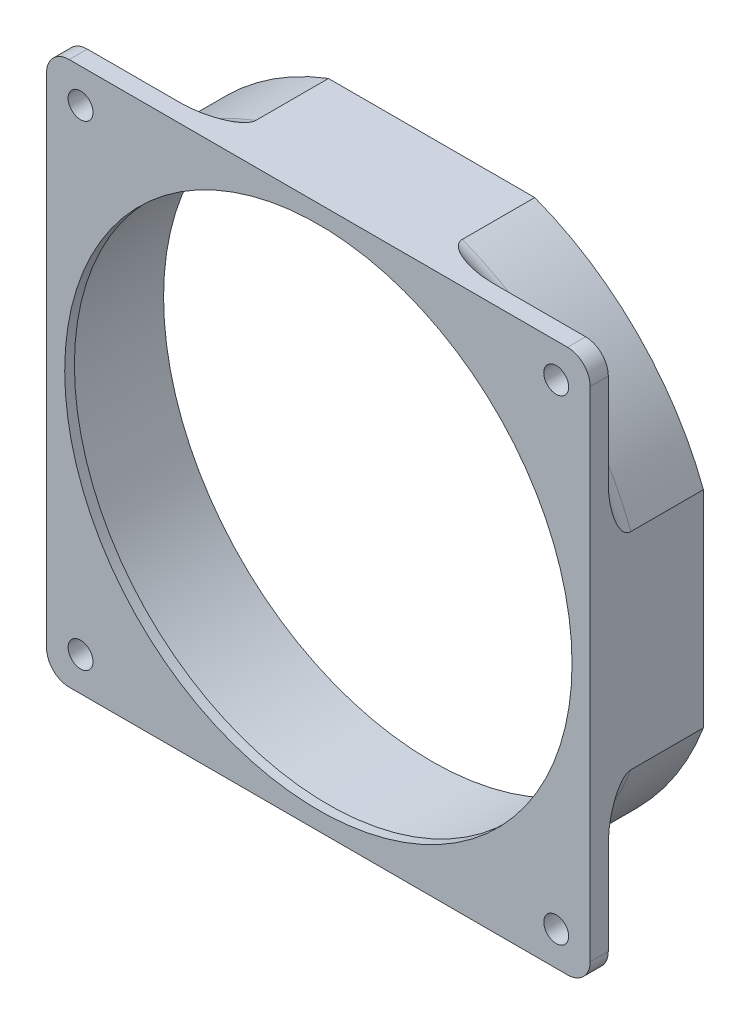
from build123d import *

# Parameters (mm, degrees)
SKETCH1_R           = 56
SKETCH1_R_2         = 2.75
BOSS_EXTRUDE1_DEPTH = 12.5
SKETCH2_R           = 59.175
SKETCH2_R_2         = 56
CUT_EXTRUDE1_DEPTH  = 22.86
CUT_EXTRUDE2_START  = -21
CUT_EXTRUDE2_DEPTH  = 21
FILLET1_R           = 5


with BuildPart() as part:
    # Sketch1 → Boss-Extrude1 (new, symmetric)
    with BuildSketch(Plane.XY):
        with BuildLine():
            Line((-55, -60), (55, -60))
            ThreePointArc((55, -60), (58.535533906, -58.535533906), (60, -55))
            Line((60, -55), (60, 55))
            ThreePointArc((60, 55), (58.535533906, 58.535533906), (55, 60))
            Line((55, 60), (-55, 60))
            ThreePointArc((-55, 60), (-58.535533906, 58.535533906), (-60, 55))
            Line((-60, 55), (-60, -55))
            ThreePointArc((-60, -55), (-58.535533906, -58.535533906), (-55, -60))
        make_face()
        Circle(SKETCH1_R, mode=Mode.SUBTRACT)
        with Locations((-52.5, 52.5)):
            Circle(SKETCH1_R_2, mode=Mode.SUBTRACT)
        with Locations((52.5, 52.5)):
            Circle(SKETCH1_R_2, mode=Mode.SUBTRACT)
        with Locations((52.5, -52.5)):
            Circle(SKETCH1_R_2, mode=Mode.SUBTRACT)
        with Locations((-52.5, -52.5)):
            Circle(SKETCH1_R_2, mode=Mode.SUBTRACT)
    extrude(amount=BOSS_EXTRUDE1_DEPTH, both=True)

    # Sketch2 → Cut-Extrude1 (cut)
    with BuildSketch(Plane(origin=(0, 0, -12.5), x_dir=(-1, 0, 0), z_dir=(0, 0, -1))):
        Circle(SKETCH2_R)
        Circle(SKETCH2_R_2, mode=Mode.SUBTRACT)
    extrude(amount=-CUT_EXTRUDE1_DEPTH, mode=Mode.SUBTRACT)

    # Sketch3 → Cut-Extrude2 (cut)
    with BuildSketch(Plane(origin=(0, 0, -12.5), x_dir=(-1, 0, 0), z_dir=(0, 0, -1)).offset(CUT_EXTRUDE2_START)):
        with BuildLine():
            Line((-60, -22.769071676), (-60, -55))
            ThreePointArc((-60, -55), (-58.535533906, -58.535533906), (-55, -60))
            Line((-55, -60), (-22.769071676, -60))
            ThreePointArc((-22.769071676, -60), (-45.378577683, -45.378577683), (-60, -22.769071676))
        make_face()
        with BuildLine():
            Line((-22.769071676, 60), (-55, 60))
            ThreePointArc((-55, 60), (-58.535533906, 58.535533906), (-60, 55))
            Line((-60, 55), (-60, 22.769071676))
            ThreePointArc((-60, 22.769071676), (-45.378577683, 45.378577683), (-22.769071676, 60))
        make_face()
        with BuildLine():
            Line((60, 22.769071676), (60, 55))
            ThreePointArc((60, 55), (58.535533906, 58.535533906), (55, 60))
            Line((55, 60), (22.769071676, 60))
            ThreePointArc((22.769071676, 60), (45.378577683, 45.378577683), (60, 22.769071676))
        make_face()
        with BuildLine():
            Line((22.769071676, -60), (55, -60))
            ThreePointArc((55, -60), (58.535533906, -58.535533906), (60, -55))
            Line((60, -55), (60, -22.769071676))
            ThreePointArc((60, -22.769071676), (45.378577683, -45.378577683), (22.769071676, -60))
        make_face()
    extrude(amount=CUT_EXTRUDE2_DEPTH, mode=Mode.SUBTRACT)

    # Fillet1
    fillet1_edges = [part.edges().sort_by_distance(p)[0] for p in [
        (-45.378577683, -45.378577683, 8.5),
        (45.378577683, 45.378577683, 8.5),
        (45.378577683, -45.378577683, 8.5),
        (-45.378577683, 45.378577683, 8.5),
    ]]
    fillet(fillet1_edges, radius=FILLET1_R)


solid = part.part
